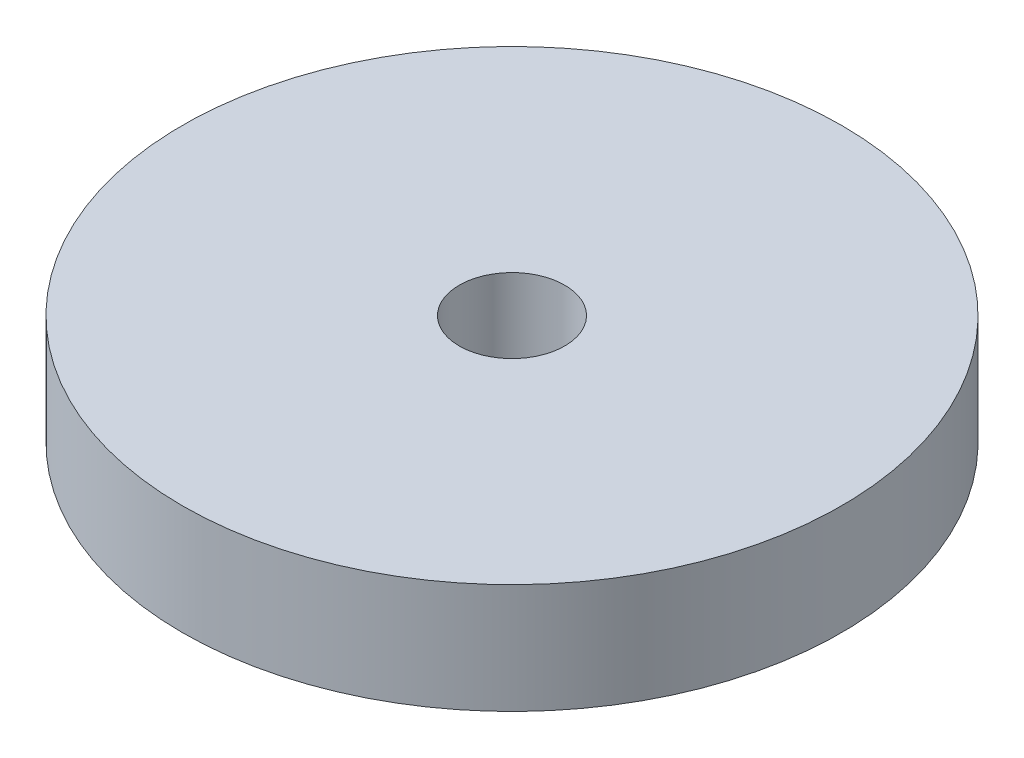
from build123d import *

# Parameters (mm, degrees)
SKETCH1_R           = 15
SKETCH1_R_2         = 2.4
BOSS_EXTRUDE1_DEPTH = 5


with BuildPart() as part:
    # Sketch1 → Boss-Extrude1 (new body)
    with BuildSketch(Plane(origin=(0, 0, 0), x_dir=(1, 0, 0), z_dir=(0, 1, 0))):
        with Locations(Location((0, 0, 0), (0, 0, 270))):
            Circle(SKETCH1_R)
        with Locations(Location((0, 0, 0), (0, 0, 270))):
            Circle(SKETCH1_R_2, mode=Mode.SUBTRACT)
    extrude(amount=BOSS_EXTRUDE1_DEPTH)


solid = part.part
